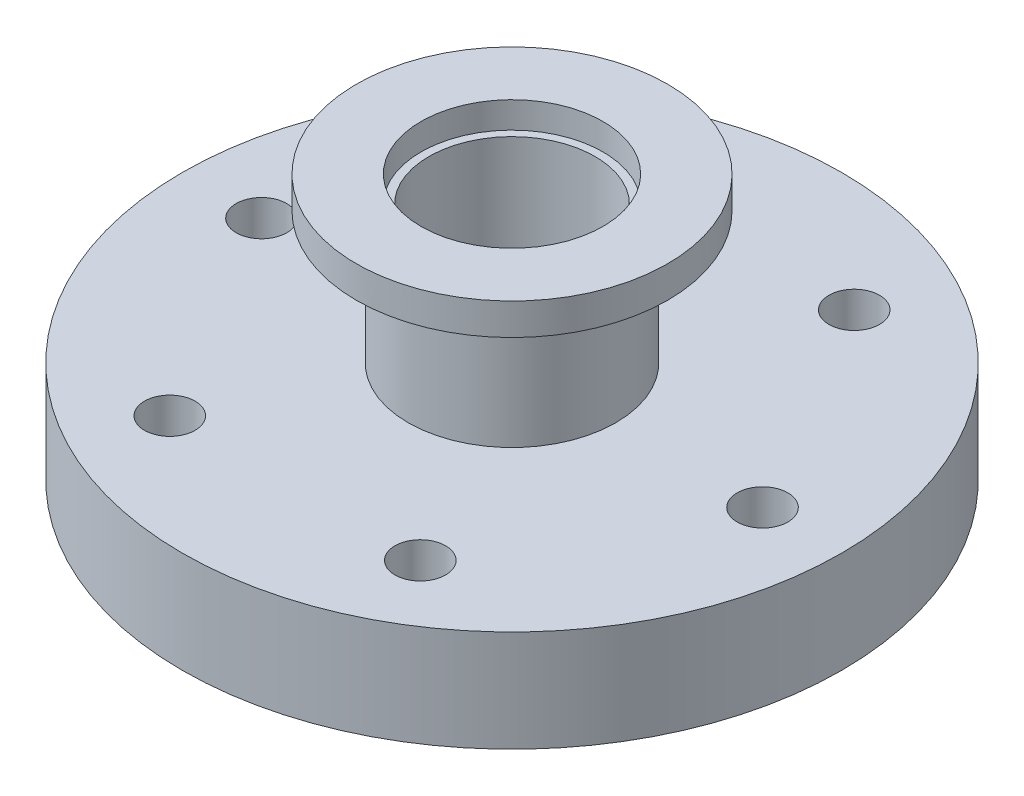
from build123d import *

# Parameters (mm, degrees)
SKETCH1_R           = 31.75
BOSS_EXTRUDE1_DEPTH = 9.779
SKETCH2_R           = 2.4384
CUT_EXTRUDE1_DEPTH  = 46.95382292
CIRPATTERN1_COUNT   = 6
SKETCH3_R           = 20.955
SKETCH3_R_2         = 17.8435
CUT_EXTRUDE2_DEPTH  = 2
SKETCH4_R           = 10
SKETCH4_R_2         = 8
BOSS_EXTRUDE2_DEPTH = 12.7
SKETCH5_R           = 14.986
BOSS_EXTRUDE3_DEPTH = 3.048
SKETCH6_R           = 8.763
CUT_EXTRUDE3_DEPTH  = 2.54
SKETCH8_R           = 8
CUT_EXTRUDE4_DEPTH  = 51.443306484


with BuildPart() as part:
    # Sketch1 → Boss-Extrude1 (new body)
    with BuildSketch(Plane(origin=(0, 0, 0), x_dir=(1, 0, 0), z_dir=(0, 1, 0))):
        with Locations(Location((0, 0, 0), (0, 0, 270))):
            Circle(SKETCH1_R)
    extrude(amount=BOSS_EXTRUDE1_DEPTH)

    # Sketch2 → Cut-Extrude1 (cut, through all)
    with BuildSketch(Plane(origin=(0, 9.779, 0), x_dir=(1, 0, 0), z_dir=(0, 1, 0))):
        with Locations(Location((-24.125, 0, 0), (0, 0, 270))):
            Circle(SKETCH2_R)
    cut_extrude1 = extrude(amount=-CUT_EXTRUDE1_DEPTH, mode=Mode.SUBTRACT)

    # CirPattern1: Cut-Extrude1 ×6 about axis
    cirpattern1_axis = Axis((0, 0, 0), (0, 1, 0))
    for i in range(1, CIRPATTERN1_COUNT):
        add(cut_extrude1.rotate(cirpattern1_axis, i * 360 / CIRPATTERN1_COUNT), mode=Mode.SUBTRACT)

    # Sketch3 → Cut-Extrude2 (cut)
    with BuildSketch(Plane.XZ):
        with Locations(Location((0, 0, 0), (0, 0, 270))):
            Circle(SKETCH3_R)
        with Locations(Location((0, 0, 0), (0, 0, 270))):
            Circle(SKETCH3_R_2, mode=Mode.SUBTRACT)
    extrude(amount=-CUT_EXTRUDE2_DEPTH, mode=Mode.SUBTRACT)

    # Sketch4 → Boss-Extrude2 (add)
    with BuildSketch(Plane(origin=(0, 9.779, 0), x_dir=(1, 0, 0), z_dir=(0, 1, 0))):
        with Locations(Location((0, 0, 0), (0, 0, 270))):
            Circle(SKETCH4_R)
        with Locations(Location((0, 0, 0), (0, 0, 270))):
            Circle(SKETCH4_R_2, mode=Mode.SUBTRACT)
    extrude(amount=BOSS_EXTRUDE2_DEPTH)

    # Sketch5 → Boss-Extrude3 (add)
    with BuildSketch(Plane(origin=(0, 22.479, 0), x_dir=(1, 0, 0), z_dir=(0, 1, 0))):
        with Locations(Location((0, 0, 0), (0, 0, 90))):
            Circle(SKETCH5_R)
    extrude(amount=BOSS_EXTRUDE3_DEPTH)

    # Sketch6 → Cut-Extrude3 (cut)
    with BuildSketch(Plane(origin=(0, 25.527, 0), x_dir=(1, 0, 0), z_dir=(0, 1, 0))):
        with Locations(Location((0, 0, 0), (0, 0, 270))):
            Circle(SKETCH6_R)
    extrude(amount=-CUT_EXTRUDE3_DEPTH, mode=Mode.SUBTRACT)

    # Sketch7 → Revolve1 (revolve)
    with BuildSketch(Plane.XY, mode=Mode.PRIVATE) as revolve1_sk:
        Polygon((-14.986, 22.479), (-10, 22.479), (-10, 21.143005327), align=None)
    revolve(revolve1_sk.sketch.rotate(Axis((0, 0, 0), (0, 1, 0)), 90), axis=Axis((0, 0, 0), (0, 1, 0)))

    # Sketch8 → Cut-Extrude4 (cut, through all)
    with BuildSketch(Plane(origin=(0, 22.987, 0), x_dir=(1, 0, 0), z_dir=(0, 1, 0))):
        with Locations(Location((0, 0, 0), (0, 0, 270))):
            Circle(SKETCH8_R)
    extrude(amount=-CUT_EXTRUDE4_DEPTH, mode=Mode.SUBTRACT)


solid = part.part
